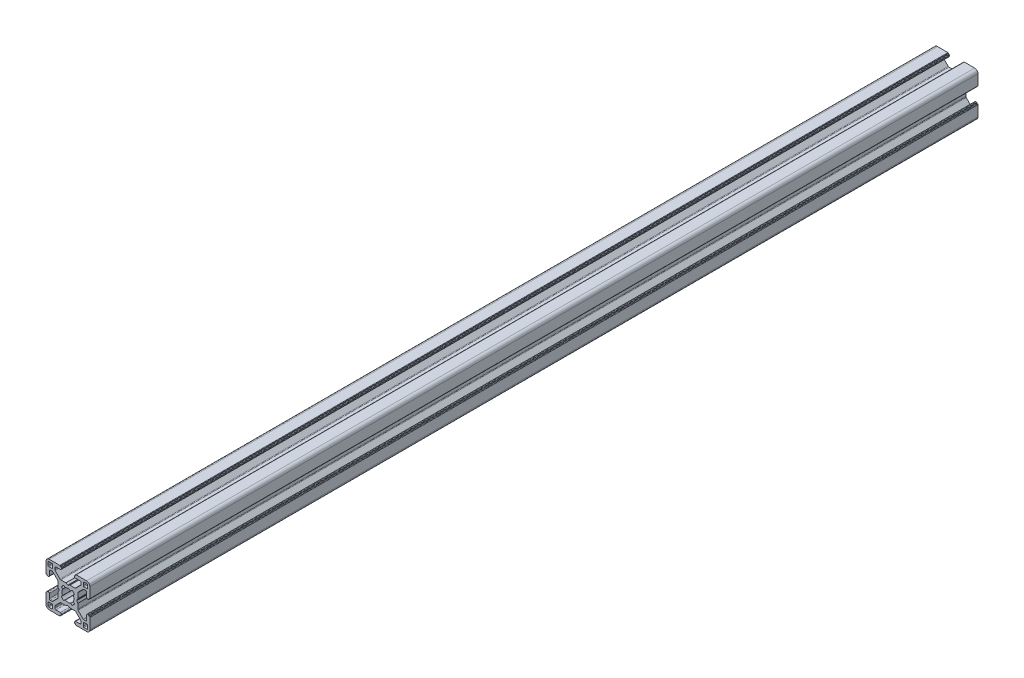
from build123d import *

# Parameters (mm, degrees)
ESTRUSIONE_ESTRUSIONE1_DEPTH = 405


with BuildPart() as part:
    # Schizzo1 → Estrusione-Estrusione1 (new body)
    with BuildSketch(Plane.XY.offset(100)):
        with BuildLine():
            Line((-9.299999732, 3), (-8.999999732, 3))
            ThreePointArc((-8.999999732, 3), (-8.646446341, 3.146446609), (-8.499999732, 3.5))
            Line((-8.499999732, 3.5), (-8.499999732, 5.499999605))
            ThreePointArc((-8.499999732, 5.499999605), (-8.353553123, 5.853552995), (-7.999999732, 5.999999605))
            Line((-7.999999732, 5.999999605), (-7.267766685, 5.999999605))
            ThreePointArc((-7.267766685, 5.999999605), (-7.076424969, 5.961939371), (-6.914213294, 5.853552995))
            Line((-6.914213294, 5.853552995), (-4.646446398, 3.585786099))
            ThreePointArc((-4.646446398, 3.585786099), (-4.538060023, 3.423574425), (-4.499999789, 3.232232708))
            Line((-4.499999789, 3.232232708), (-4.499999789, 0.953589302))
            ThreePointArc((-4.499999789, 0.953589302), (-4.493184953, 0.90182549), (-4.473204867, 0.853589297))
            Line((-4.473204867, 0.853589297), (-4.038119841, 0.099999969))
            ThreePointArc((-4.038119841, 0.099999969), (-4.011324929, 0), (-4.038119841, -0.099999969))
            Line((-4.038119841, -0.099999969), (-4.473204867, -0.853589297))
            ThreePointArc((-4.473204867, -0.853589297), (-4.493184953, -0.90182549), (-4.499999789, -0.953589302))
            Line((-4.499999789, -0.953589302), (-4.499999789, -3.232232708))
            ThreePointArc((-4.499999789, -3.232232708), (-4.538060023, -3.423574425), (-4.646446398, -3.585786099))
            Line((-4.646446398, -3.585786099), (-6.914213294, -5.853552995))
            ThreePointArc((-6.914213294, -5.853552995), (-7.076424969, -5.961939371), (-7.267766685, -5.999999605))
            Line((-7.267766685, -5.999999605), (-7.999999732, -5.999999605))
            ThreePointArc((-7.999999732, -5.999999605), (-8.353553123, -5.853552995), (-8.499999732, -5.499999605))
            Line((-8.499999732, -5.499999605), (-8.499999732, -3.5))
            ThreePointArc((-8.499999732, -3.5), (-8.646446341, -3.146446609), (-8.999999732, -3))
            Line((-8.999999732, -3), (-9.299999732, -3))
            ThreePointArc((-9.299999732, -3), (-9.441421088, -3.058578644), (-9.499999732, -3.2))
            Line((-9.499999732, -3.2), (-9.499999732, -3.349999605))
            ThreePointArc((-9.499999732, -3.349999605), (-9.558578376, -3.491420961), (-9.699999732, -3.549999605))
            Line((-9.699999732, -3.549999605), (-9.8, -3.549999605))
            ThreePointArc((-9.8, -3.549999605), (-9.941421356, -3.608578248), (-10, -3.749999605))
            Line((-10, -3.749999605), (-10, -8.5))
            ThreePointArc((-10, -8.5), (-9.560660172, -9.560660172), (-8.5, -10))
            Line((-8.5, -10), (-3.750000228, -10))
            ThreePointArc((-3.750000228, -10), (-3.608578871, -9.941421356), (-3.550000228, -9.8))
            Line((-3.550000228, -9.8), (-3.550000228, -9.7))
            ThreePointArc((-3.550000228, -9.7), (-3.491421584, -9.558578644), (-3.350000228, -9.5))
            Line((-3.350000228, -9.5), (-3.2, -9.5))
            ThreePointArc((-3.2, -9.5), (-3.058578644, -9.441421356), (-3, -9.3))
            Line((-3, -9.3), (-3, -8.999999673))
            ThreePointArc((-3, -8.999999673), (-3.146446609, -8.646446283), (-3.5, -8.499999673))
            Line((-3.5, -8.499999673), (-5.500000686, -8.499999673))
            ThreePointArc((-5.500000686, -8.499999673), (-5.853554077, -8.353553064), (-6.000000686, -7.999999673))
            Line((-6.000000686, -7.999999673), (-6.000000686, -7.267766626))
            ThreePointArc((-6.000000686, -7.267766626), (-5.961940448, -7.076424899), (-5.853554059, -6.914213219))
            Line((-5.853554059, -6.914213219), (-3.585787212, -4.646446592))
            ThreePointArc((-3.585787212, -4.646446592), (-3.423575544, -4.538060229), (-3.232233839, -4.5))
            Line((-3.232233839, -4.5), (-0.953590312, -4.5))
            ThreePointArc((-0.953590312, -4.5), (-0.901826505, -4.493185166), (-0.853590316, -4.473205083))
            Line((-0.853590316, -4.473205083), (-0.100000045, -4.038119562))
            ThreePointArc((-0.100000045, -4.038119562), (0, -4.011324632), (0.100000045, -4.038119562))
            Line((0.100000045, -4.038119562), (0.853590316, -4.473205083))
            ThreePointArc((0.853590316, -4.473205083), (0.901826505, -4.493185166), (0.953590312, -4.5))
            Line((0.953590312, -4.5), (3.23223292, -4.5))
            ThreePointArc((3.23223292, -4.5), (3.423574636, -4.538060234), (3.58578631, -4.646446609))
            Line((3.58578631, -4.646446609), (5.853554077, -6.914214376))
            ThreePointArc((5.853554077, -6.914214376), (5.961940452, -7.07642605), (6.000000686, -7.267767766))
            Line((6.000000686, -7.267767766), (6.000000686, -7.999999673))
            ThreePointArc((6.000000686, -7.999999673), (5.853554077, -8.353553064), (5.500000686, -8.499999673))
            Line((5.500000686, -8.499999673), (3.5, -8.499999673))
            ThreePointArc((3.5, -8.499999673), (3.146446609, -8.646446283), (3, -8.999999673))
            Line((3, -8.999999673), (3, -9.3))
            ThreePointArc((3, -9.3), (3.058578644, -9.441421356), (3.2, -9.5))
            Line((3.2, -9.5), (3.350000228, -9.5))
            ThreePointArc((3.350000228, -9.5), (3.491421584, -9.558578644), (3.550000228, -9.7))
            Line((3.550000228, -9.7), (3.550000228, -9.8))
            ThreePointArc((3.550000228, -9.8), (3.608578871, -9.941421356), (3.750000228, -10))
            Line((3.750000228, -10), (8.5, -10))
            ThreePointArc((8.5, -10), (9.560660172, -9.560660172), (10, -8.5))
            Line((10, -8.5), (10, -3.749999605))
            ThreePointArc((10, -3.749999605), (9.941421356, -3.608578248), (9.8, -3.549999605))
            Line((9.8, -3.549999605), (9.699999732, -3.549999605))
            ThreePointArc((9.699999732, -3.549999605), (9.558578376, -3.491420961), (9.499999732, -3.349999605))
            Line((9.499999732, -3.349999605), (9.499999732, -3.2))
            ThreePointArc((9.499999732, -3.2), (9.441421088, -3.058578644), (9.299999732, -3))
            Line((9.299999732, -3), (8.999999732, -3))
            ThreePointArc((8.999999732, -3), (8.646446341, -3.146446609), (8.499999732, -3.5))
            Line((8.499999732, -3.5), (8.499999732, -5.499999605))
            ThreePointArc((8.499999732, -5.499999605), (8.353553123, -5.853552995), (7.999999732, -5.999999605))
            Line((7.999999732, -5.999999605), (7.267766789, -5.999999605))
            ThreePointArc((7.267766789, -5.999999605), (7.076425084, -5.961939376), (6.914213416, -5.853553012))
            Line((6.914213416, -5.853553012), (4.646446415, -3.585786233))
            ThreePointArc((4.646446415, -3.585786233), (4.538060027, -3.423574553), (4.499999789, -3.232232825))
            Line((4.499999789, -3.232232825), (4.499999789, -0.953589302))
            ThreePointArc((4.499999789, -0.953589302), (4.493184953, -0.90182549), (4.473204867, -0.853589297))
            Line((4.473204867, -0.853589297), (4.038119841, -0.099999969))
            ThreePointArc((4.038119841, -0.099999969), (4.011324929, 0), (4.038119841, 0.099999969))
            Line((4.038119841, 0.099999969), (4.473204867, 0.853589297))
            ThreePointArc((4.473204867, 0.853589297), (4.493184953, 0.90182549), (4.499999789, 0.953589302))
            Line((4.499999789, 0.953589302), (4.499999789, 3.232232825))
            ThreePointArc((4.499999789, 3.232232825), (4.538060027, 3.423574553), (4.646446415, 3.585786233))
            Line((4.646446415, 3.585786233), (6.914213416, 5.853553012))
            ThreePointArc((6.914213416, 5.853553012), (7.076425084, 5.961939376), (7.267766789, 5.999999605))
            Line((7.267766789, 5.999999605), (7.999999732, 5.999999605))
            ThreePointArc((7.999999732, 5.999999605), (8.353553123, 5.853552995), (8.499999732, 5.499999605))
            Line((8.499999732, 5.499999605), (8.499999732, 3.5))
            ThreePointArc((8.499999732, 3.5), (8.646446341, 3.146446609), (8.999999732, 3))
            Line((8.999999732, 3), (9.299999732, 3))
            ThreePointArc((9.299999732, 3), (9.441421088, 3.058578644), (9.499999732, 3.2))
            Line((9.499999732, 3.2), (9.499999732, 3.349999605))
            ThreePointArc((9.499999732, 3.349999605), (9.558578376, 3.491420961), (9.699999732, 3.549999605))
            Line((9.699999732, 3.549999605), (9.8, 3.549999605))
            ThreePointArc((9.8, 3.549999605), (9.941421356, 3.608578248), (10, 3.749999605))
            Line((10, 3.749999605), (10, 8.5))
            ThreePointArc((10, 8.5), (9.560660172, 9.560660172), (8.5, 10))
            Line((8.5, 10), (3.750000228, 10))
            ThreePointArc((3.750000228, 10), (3.608578871, 9.941421356), (3.550000228, 9.8))
            Line((3.550000228, 9.8), (3.550000228, 9.7))
            ThreePointArc((3.550000228, 9.7), (3.491421584, 9.558578644), (3.350000228, 9.5))
            Line((3.350000228, 9.5), (3.2, 9.5))
            ThreePointArc((3.2, 9.5), (3.058578644, 9.441421356), (3, 9.3))
            Line((3, 9.3), (3, 8.999999673))
            ThreePointArc((3, 8.999999673), (3.146446609, 8.646446283), (3.5, 8.499999673))
            Line((3.5, 8.499999673), (5.500000686, 8.499999673))
            ThreePointArc((5.500000686, 8.499999673), (5.853554077, 8.353553064), (6.000000686, 7.999999673))
            Line((6.000000686, 7.999999673), (6.000000686, 7.267767766))
            ThreePointArc((6.000000686, 7.267767766), (5.961940452, 7.07642605), (5.853554077, 6.914214376))
            Line((5.853554077, 6.914214376), (3.58578631, 4.646446609))
            ThreePointArc((3.58578631, 4.646446609), (3.423574636, 4.538060234), (3.23223292, 4.5))
            Line((3.23223292, 4.5), (0.953590312, 4.5))
            ThreePointArc((0.953590312, 4.5), (0.901826505, 4.493185166), (0.853590316, 4.473205083))
            Line((0.853590316, 4.473205083), (0.100000045, 4.038119562))
            ThreePointArc((0.100000045, 4.038119562), (0, 4.011324632), (-0.100000045, 4.038119562))
            Line((-0.100000045, 4.038119562), (-0.853590316, 4.473205083))
            ThreePointArc((-0.853590316, 4.473205083), (-0.901826505, 4.493185166), (-0.953590312, 4.5))
            Line((-0.953590312, 4.5), (-3.232233839, 4.5))
            ThreePointArc((-3.232233839, 4.5), (-3.423575544, 4.538060229), (-3.585787212, 4.646446592))
            Line((-3.585787212, 4.646446592), (-5.853554059, 6.914213219))
            ThreePointArc((-5.853554059, 6.914213219), (-5.961940448, 7.076424899), (-6.000000686, 7.267766626))
            Line((-6.000000686, 7.267766626), (-6.000000686, 7.999999673))
            ThreePointArc((-6.000000686, 7.999999673), (-5.853554077, 8.353553064), (-5.500000686, 8.499999673))
            Line((-5.500000686, 8.499999673), (-3.5, 8.499999673))
            ThreePointArc((-3.5, 8.499999673), (-3.146446609, 8.646446283), (-3, 8.999999673))
            Line((-3, 8.999999673), (-3, 9.3))
            ThreePointArc((-3, 9.3), (-3.058578644, 9.441421356), (-3.2, 9.5))
            Line((-3.2, 9.5), (-3.350000228, 9.5))
            ThreePointArc((-3.350000228, 9.5), (-3.491421584, 9.558578644), (-3.550000228, 9.7))
            Line((-3.550000228, 9.7), (-3.550000228, 9.8))
            ThreePointArc((-3.550000228, 9.8), (-3.608578871, 9.941421356), (-3.750000228, 10))
            Line((-3.750000228, 10), (-8.5, 10))
            ThreePointArc((-8.5, 10), (-9.560660172, 9.560660172), (-10, 8.5))
            Line((-10, 8.5), (-10, 3.749999605))
            ThreePointArc((-10, 3.749999605), (-9.941421356, 3.608578248), (-9.8, 3.549999605))
            Line((-9.8, 3.549999605), (-9.699999732, 3.549999605))
            ThreePointArc((-9.699999732, 3.549999605), (-9.558578376, 3.491420961), (-9.499999732, 3.349999605))
            Line((-9.499999732, 3.349999605), (-9.499999732, 3.2))
            ThreePointArc((-9.499999732, 3.2), (-9.441421088, 3.058578644), (-9.299999732, 3))
        make_face()
        with BuildLine():
            Line((-1.91389502, 2.989640962), (-1.258185436, 2.445295362))
            ThreePointArc((-1.258185436, 2.445295362), (0, 2.75), (1.258185436, 2.445295362))
            Line((1.258185436, 2.445295362), (1.91389502, 2.989640962))
            ThreePointArc((1.91389502, 2.989640962), (2.511737261, 2.508410485), (2.992174953, 1.909930962))
            Line((2.992174953, 1.909930962), (2.445295423, 1.258185317))
            ThreePointArc((2.445295423, 1.258185317), (2.75, 0), (2.445295423, -1.258185317))
            Line((2.445295423, -1.258185317), (2.992174953, -1.909930962))
            ThreePointArc((2.992174953, -1.909930962), (2.511737261, -2.508410485), (1.91389502, -2.989640962))
            Line((1.91389502, -2.989640962), (1.258185436, -2.445295362))
            ThreePointArc((1.258185436, -2.445295362), (0, -2.75), (-1.258185436, -2.445295362))
            Line((-1.258185436, -2.445295362), (-1.91389502, -2.989640962))
            ThreePointArc((-1.91389502, -2.989640962), (-2.511737261, -2.508410485), (-2.992174953, -1.909930962))
            Line((-2.992174953, -1.909930962), (-2.445295423, -1.258185317))
            ThreePointArc((-2.445295423, -1.258185317), (-2.75, 0), (-2.445295423, 1.258185317))
            Line((-2.445295423, 1.258185317), (-2.992174953, 1.909930962))
            ThreePointArc((-2.992174953, 1.909930962), (-2.511737261, 2.508410485), (-1.91389502, 2.989640962))
        make_face(mode=Mode.SUBTRACT)
        with BuildLine():
            Line((8.699999314, 7.000000686), (7.3, 7.000000686))
            ThreePointArc((7.3, 7.000000686), (7.087867966, 7.087868652), (7, 7.300000686))
            Line((7, 7.300000686), (7, 8.7))
            ThreePointArc((7, 8.7), (7.087867966, 8.912132034), (7.3, 9))
            Line((7.3, 9), (8.699999314, 9))
            ThreePointArc((8.699999314, 9), (8.912131348, 8.912132034), (8.999999314, 8.7))
            Line((8.999999314, 8.7), (8.999999314, 7.300000686))
            ThreePointArc((8.999999314, 7.300000686), (8.912131348, 7.087868652), (8.699999314, 7.000000686))
        make_face(mode=Mode.SUBTRACT)
        with BuildLine():
            Line((-7.300000686, 7.000000686), (-8.7, 7.000000686))
            ThreePointArc((-8.7, 7.000000686), (-8.912132034, 7.087868652), (-9, 7.300000686))
            Line((-9, 7.300000686), (-9, 8.7))
            ThreePointArc((-9, 8.7), (-8.912132034, 8.912132034), (-8.7, 9))
            Line((-8.7, 9), (-7.300000686, 9))
            ThreePointArc((-7.300000686, 9), (-7.087868652, 8.912132034), (-7.000000686, 8.7))
            Line((-7.000000686, 8.7), (-7.000000686, 7.300000686))
            ThreePointArc((-7.000000686, 7.300000686), (-7.087868652, 7.087868652), (-7.300000686, 7.000000686))
        make_face(mode=Mode.SUBTRACT)
        with BuildLine():
            Line((8.699999314, -8.999999314), (7.3, -8.999999314))
            ThreePointArc((7.3, -8.999999314), (7.087867966, -8.912131348), (7, -8.699999314))
            Line((7, -8.699999314), (7, -7.3))
            ThreePointArc((7, -7.3), (7.087867966, -7.087867966), (7.3, -7))
            Line((7.3, -7), (8.699999314, -7))
            ThreePointArc((8.699999314, -7), (8.912131348, -7.087867966), (8.999999314, -7.3))
            Line((8.999999314, -7.3), (8.999999314, -8.699999314))
            ThreePointArc((8.999999314, -8.699999314), (8.912131348, -8.912131348), (8.699999314, -8.999999314))
        make_face(mode=Mode.SUBTRACT)
        with BuildLine():
            Line((-7.300000686, -8.999999314), (-8.7, -8.999999314))
            ThreePointArc((-8.7, -8.999999314), (-8.912132034, -8.912131348), (-9, -8.699999314))
            Line((-9, -8.699999314), (-9, -7.3))
            ThreePointArc((-9, -7.3), (-8.912132034, -7.087867966), (-8.7, -7))
            Line((-8.7, -7), (-7.300000686, -7))
            ThreePointArc((-7.300000686, -7), (-7.087868652, -7.087867966), (-7.000000686, -7.3))
            Line((-7.000000686, -7.3), (-7.000000686, -8.699999314))
            ThreePointArc((-7.000000686, -8.699999314), (-7.087868652, -8.912131348), (-7.300000686, -8.999999314))
        make_face(mode=Mode.SUBTRACT)
    extrude(amount=-ESTRUSIONE_ESTRUSIONE1_DEPTH)


solid = part.part
